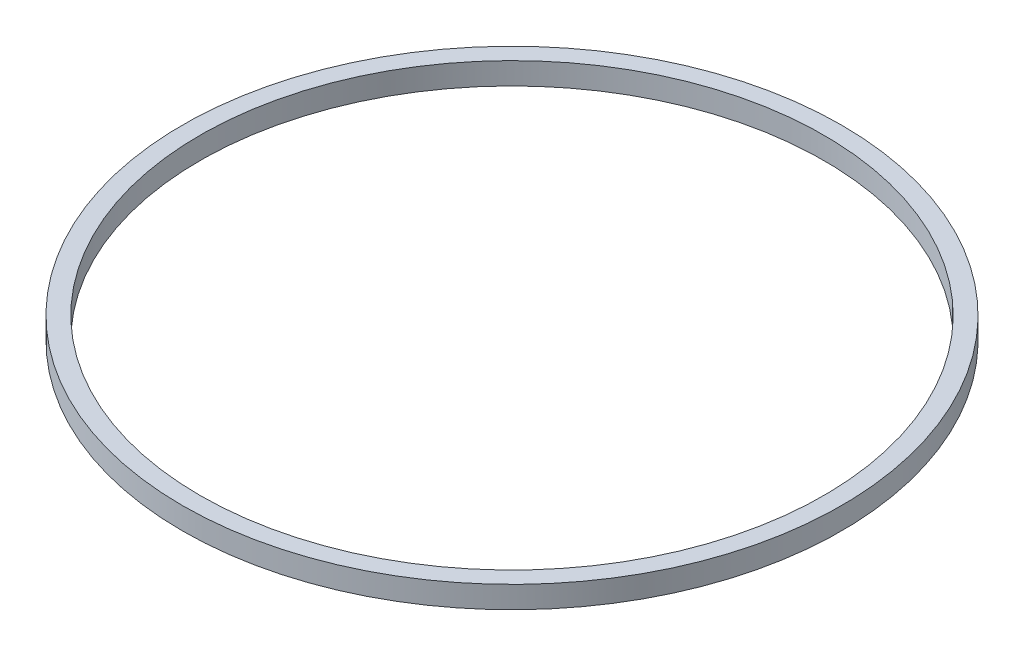
from build123d import *

# Parameters (mm, degrees)
SKETCH1_R           = 75
SKETCH1_R_2         = 71
BOSS_EXTRUDE1_DEPTH = 5


with BuildPart() as part:
    # Sketch1 → Boss-Extrude1 (new body)
    with BuildSketch(Plane(origin=(0, 0, 0), x_dir=(1, 0, 0), z_dir=(0, 1, 0))):
        with Locations(Location((0, 0, 0), (0, 0, 270))):
            Circle(SKETCH1_R)
        with Locations(Location((0, 0, 0), (0, 0, 270))):
            Circle(SKETCH1_R_2, mode=Mode.SUBTRACT)
    extrude(amount=BOSS_EXTRUDE1_DEPTH)


solid = part.part
